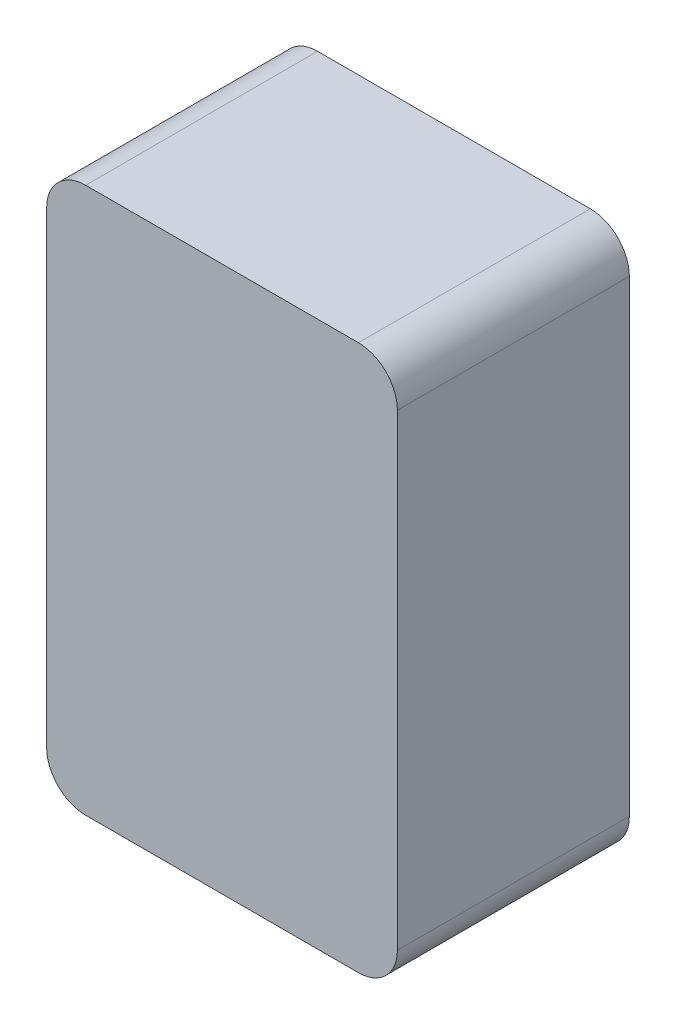
from build123d import *

# Parameters (mm, degrees)
SKETCH1_W           = 28.575
SKETCH1_H           = 44.45
BOSS_EXTRUDE1_DEPTH = 18.8976
FILLET1_R           = 3.175


with BuildPart() as part:
    # Sketch1 → Boss-Extrude1 (new body)
    with BuildSketch(Plane.XY):
        Rectangle(SKETCH1_W, SKETCH1_H)
    extrude(amount=BOSS_EXTRUDE1_DEPTH)

    # Fillet1
    fillet1_edges = [part.edges().sort_by_distance(p)[0] for p in [
        (14.2875, -22.225, 9.4488),
        (-14.2875, -22.225, 9.4488),
        (-14.2875, 22.225, 9.4488),
        (14.2875, 22.225, 9.4488),
    ]]
    fillet(fillet1_edges, radius=FILLET1_R)


solid = part.part
